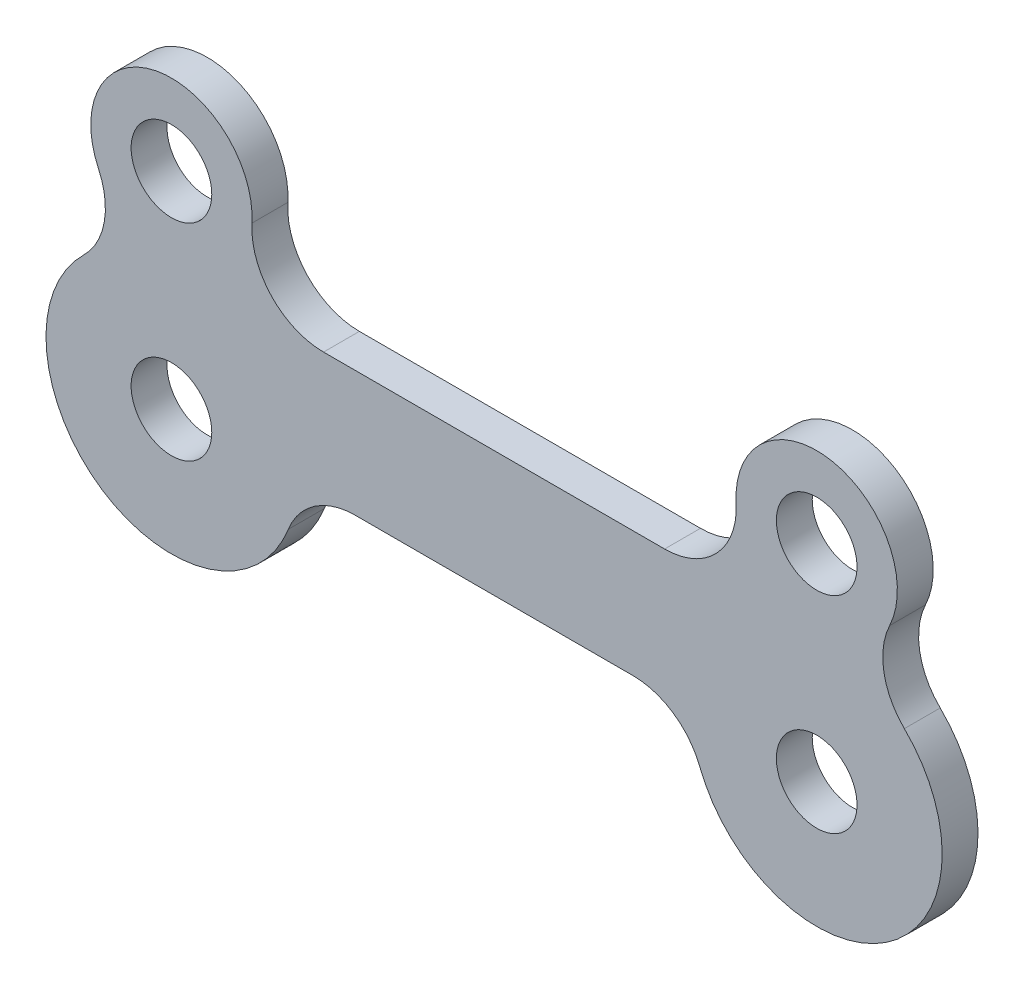
from build123d import *

# Parameters (mm, degrees)
SKETCH1_R            = 1.7859375
BOSS_EXTRUDE1_DEPTH  = 1.5875
FILLET1_R            = 3.175
FILLET1_OF_MIRROR1_R = 3.175


with BuildPart() as part:
    # Sketch1 → Boss-Extrude1 (new body)
    with BuildSketch(Plane.XY):
        with BuildLine():
            Line((-8.73125, 0), (0, 0))
            Line((0, 0), (0, 5.55625))
            Line((0, 5.55625), (-7.552307909, 5.55625))
            ThreePointArc((-7.552307909, 5.55625), (-9.862459716, 6.553217945), (-10.721810073, 8.918014642))
            ThreePointArc((-10.721810073, 8.918014642), (-14.966353253, 12.634896917), (-17.517188185, 7.602541425))
            ThreePointArc((-17.517188185, 7.602541425), (-17.263166539, 5.68441597), (-18.169650628, 3.9750246))
            ThreePointArc((-18.169650628, 3.9750246), (-16.444084642, -5.120650031), (-8.73125, 0))
        make_face()
        with Locations((-14.2875, 0)):
            Circle(SKETCH1_R, mode=Mode.SUBTRACT)
        with Locations((-14.2875, 9.128125)):
            Circle(SKETCH1_R, mode=Mode.SUBTRACT)
    boss_extrude1 = extrude(amount=BOSS_EXTRUDE1_DEPTH)

    # Fillet1
    fillet1_edges = [part.edges().sort_by_distance(p)[0] for p in [
        (-8.73125, 0, 0.79375),
    ]]
    fillet(fillet1_edges, radius=FILLET1_R)

    # Mirror1: Boss-Extrude1 across plane
    add(boss_extrude1.mirror(Plane(origin=(0, 0, 1.5875), x_dir=(0, 0, 1), z_dir=(1, 0, 0))))

    # Fillet1 of Mirror1
    fillet1_of_mirror1_edges = [part.edges().sort_by_distance(p)[0] for p in [
        (8.73125, 0, 0.79375),
    ]]
    fillet(fillet1_of_mirror1_edges, radius=FILLET1_OF_MIRROR1_R)


solid = part.part
